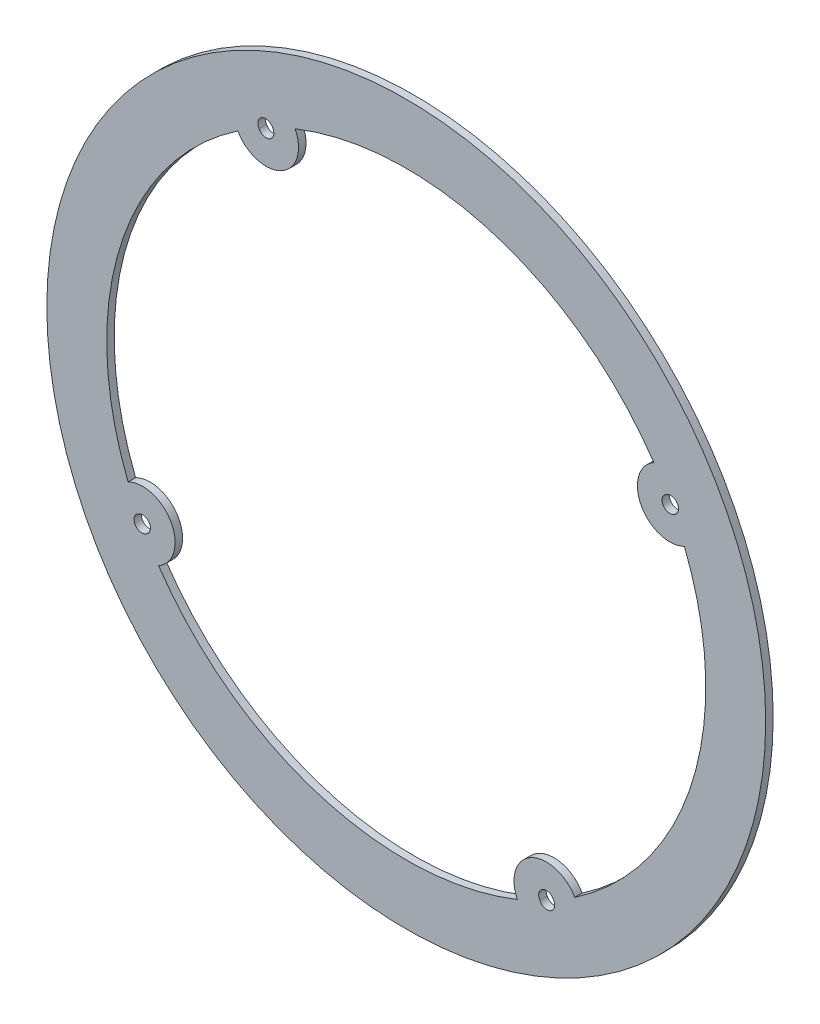
from build123d import *

# Parameters (mm, degrees)
SKETCH1_R           = 76.2
SKETCH1_R_2         = 63.5
BOSS_EXTRUDE1_DEPTH = 1.5875
SKETCH2_R           = 1.651
BOSS_EXTRUDE2_DEPTH = 1.5875
SKETCH4_R           = 1.651
CUT_EXTRUDE2_DEPTH  = 1.5875
CIRPATTERN2_COUNT   = 4
CIRPATTERN3_COUNT   = 4


with BuildPart() as part:
    # Sketch1 → Boss-Extrude1 (new body)
    with BuildSketch(Plane.XY):
        Circle(SKETCH1_R)
        Circle(SKETCH1_R_2, mode=Mode.SUBTRACT)
    extrude(amount=BOSS_EXTRUDE1_DEPTH)

    # Sketch2 → Boss-Extrude2 (add)
    with BuildSketch(Plane.XY.offset(1.5875)):
        with BuildLine():
            Line((-36.496083221, 54.681087122), (-25.299953382, 61.158320597))
            ThreePointArc((-25.299953382, 61.158320597), (-26.271105519, 49.921919547), (-36.496083221, 54.681087122))
        make_face()
        with Locations((-29.718, 55.88)):
            Circle(SKETCH2_R, mode=Mode.SUBTRACT)
    boss_extrude2 = extrude(amount=-BOSS_EXTRUDE2_DEPTH)

    # Sketch4 → Cut-Extrude2 (cut)
    with BuildSketch(Plane.XY.offset(1.5875)):
        with Locations((-29.81619736, 56.064644608)):
            Circle(SKETCH4_R)
    cut_extrude2 = extrude(amount=-CUT_EXTRUDE2_DEPTH, mode=Mode.SUBTRACT)

    # CirPattern2: Boss-Extrude2 ×4 about axis
    cirpattern2_axis = Axis((0, 0, 0), (0, 0, 1))
    for i in range(1, CIRPATTERN2_COUNT):
        add(boss_extrude2.rotate(cirpattern2_axis, i * 360 / CIRPATTERN2_COUNT))

    # CirPattern3: Cut-Extrude2 ×4 about axis
    cirpattern3_axis = Axis((0, 0, 0), (0, 0, 1))
    for i in range(1, CIRPATTERN3_COUNT):
        add(cut_extrude2.rotate(cirpattern3_axis, i * 360 / CIRPATTERN3_COUNT), mode=Mode.SUBTRACT)


solid = part.part
